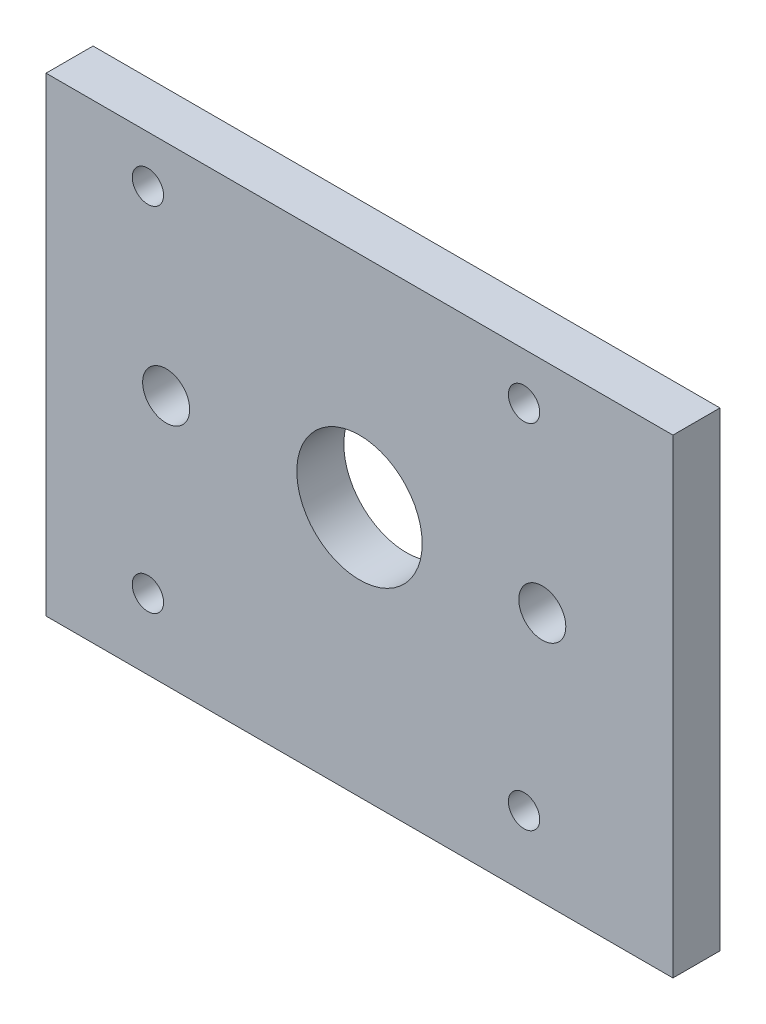
from build123d import *

# Parameters (mm, degrees)
SKETCH_1_W      = 80
SKETCH_1_H      = 60
SKETCH_1_R      = 3
SKETCH_1_R_2    = 2
SKETCH_1_R_3    = 8
EXTRUDE_1_DEPTH = 6


with BuildPart() as part:
    # 草图1 → 凸台-拉伸1 (new body)
    with BuildSketch(Plane.XY):
        with Locations((0, 5)):
            Rectangle(SKETCH_1_W, SKETCH_1_H)
        with Locations((23.328121258, 7)):
            Circle(SKETCH_1_R, mode=Mode.SUBTRACT)
        with Locations((-24.671878742, 7)):
            Circle(SKETCH_1_R, mode=Mode.SUBTRACT)
        with Locations((-27, 29)):
            Circle(SKETCH_1_R_2, mode=Mode.SUBTRACT)
        with Locations((21, 29)):
            Circle(SKETCH_1_R_2, mode=Mode.SUBTRACT)
        with Locations((-27, -16)):
            Circle(SKETCH_1_R_2, mode=Mode.SUBTRACT)
        with Locations((21, -16)):
            Circle(SKETCH_1_R_2, mode=Mode.SUBTRACT)
        with Locations((0, 7)):
            Circle(SKETCH_1_R_3, mode=Mode.SUBTRACT)
    extrude(amount=EXTRUDE_1_DEPTH)


solid = part.part
